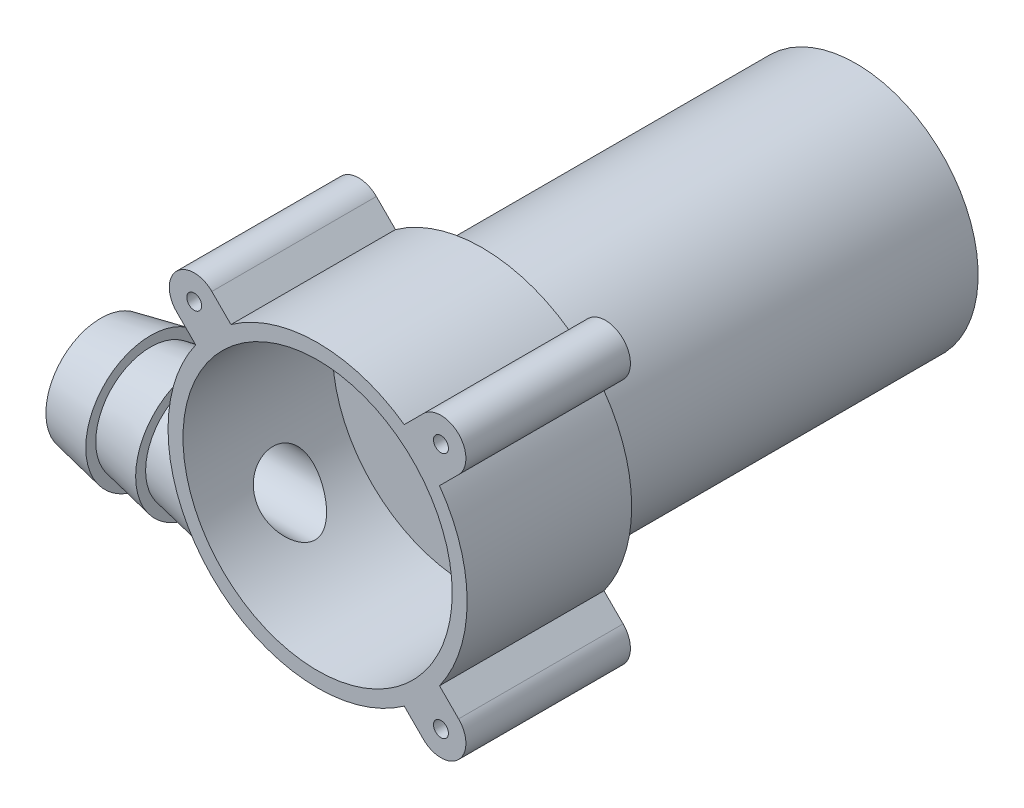
from build123d import *

# Parameters (mm, degrees)
SKETCH1_R                       = 24.5
SKETCH1_R_2                     = 1.5
SKETCH1_R_3                     = 1.75
BOSS_EXTRUDE1_DEPTH             = 3
SKETCH2_R                       = 10
SKETCH2_R_2                     = 8.75
BOSS_EXTRUDE2_DEPTH             = 7
BOSS_EXTRUDE3_START             = 75
SKETCH3_R                       = 24.5
SKETCH3_R_2                     = 23
BOSS_EXTRUDE3_DEPTH             = 75
BOSS_EXTRUDE4_START             = -3
SKETCH4_R                       = 30
SKETCH4_R_2                     = 24.5
BOSS_EXTRUDE4_DEPTH             = 3
SKETCH5_R                       = 30
SKETCH5_R_2                     = 27
BOSS_EXTRUDE5_DEPTH             = 30
BOSS_EXTRUDE6_REACH             = 108.888
BOSS_EXTRUDE6_END_RADIUS        = 30
SKETCH6_R                       = 11
SKETCH6_R_2                     = 6
BOSS_EXTRUDE6_DIRECTION_2_DEPTH = 20
CUT_EXTRUDE1_REACH              = 122.934
SKETCH9_R                       = 6
SKETCH11_R                      = 1.5
BOSS_EXTRUDE7_DEPTH             = 33
CIRPATTERN1_COUNT               = 3
CIRPATTERN1_ANGLE               = 180


with BuildPart() as part:
    # Sketch1 → Boss-Extrude1 (new body)
    with BuildSketch(Plane.XY):
        Circle(SKETCH1_R)
        with Locations((14.5, 0)):
            Circle(SKETCH1_R_2, mode=Mode.SUBTRACT)
        with Locations((0, -14.5)):
            Circle(SKETCH1_R_2, mode=Mode.SUBTRACT)
        with Locations((-14.5, 0)):
            Circle(SKETCH1_R_2, mode=Mode.SUBTRACT)
        with Locations((0, 14.5)):
            Circle(SKETCH1_R_2, mode=Mode.SUBTRACT)
        Circle(SKETCH1_R_3, mode=Mode.SUBTRACT)
    extrude(amount=BOSS_EXTRUDE1_DEPTH)

    # Sketch2 → Boss-Extrude2 (add)
    with BuildSketch(Plane(origin=(0, 0, 0), x_dir=(-1, 0, 0), z_dir=(0, 0, -1))):
        with Locations(Location((0, 0, 0), (0, 0, 180))):
            Circle(SKETCH2_R)
        Circle(SKETCH2_R_2, mode=Mode.SUBTRACT)
    extrude(amount=BOSS_EXTRUDE2_DEPTH)

    # Sketch3 → Boss-Extrude3 (add)
    with BuildSketch(Plane(origin=(0, 0, 0), x_dir=(-1, 0, 0), z_dir=(0, 0, -1)).offset(BOSS_EXTRUDE3_START)):
        Circle(SKETCH3_R)
        Circle(SKETCH3_R_2, mode=Mode.SUBTRACT)
    extrude(amount=-BOSS_EXTRUDE3_DEPTH)

    # Sketch4 → Boss-Extrude4 (add)
    with BuildSketch(Plane.XY.offset(3).offset(BOSS_EXTRUDE4_START)):
        Circle(SKETCH4_R)
        with Locations(Location((0, 0, 0), (0, 0, 180))):
            Circle(SKETCH4_R_2, mode=Mode.SUBTRACT)
    extrude(amount=BOSS_EXTRUDE4_DEPTH)

    # Sketch5 → Boss-Extrude5 (add)
    with BuildSketch(Plane.XY.offset(3)):
        Circle(SKETCH5_R)
        Circle(SKETCH5_R_2, mode=Mode.SUBTRACT)
    extrude(amount=BOSS_EXTRUDE5_DEPTH)

    # Boss-Extrude6: up to this cylinder (the profile starts outside it)
    boss_extrude6_end = Plane(origin=(0, 0, 27.188873), z_dir=(0, 0, 1)) * Cylinder(BOSS_EXTRUDE6_END_RADIUS, 278.776, mode=Mode.PRIVATE)
    # Sketch6 → Boss-Extrude6 (add, up to the surface)
    with BuildSketch(Plane(origin=(-40, 0, 0), x_dir=(0, 0, -1), z_dir=(1, 0, 0)), mode=Mode.PRIVATE) as boss_extrude6_sk1:
        with Locations((-16.5, -15)):
            Circle(SKETCH6_R)
        with Locations((-16.5, -15)):
            Circle(SKETCH6_R_2, mode=Mode.SUBTRACT)
    boss_extrude6_tool1 = extrude(boss_extrude6_sk1.sketch, amount=BOSS_EXTRUDE6_REACH, mode=Mode.PRIVATE) - boss_extrude6_end
    add(boss_extrude6_tool1.solids().sort_by_distance((-40, -15, 27.188873))[0])

    # Sketch6 → Boss-Extrude6 direction 2 (add)
    with BuildSketch(Plane(origin=(-40, 0, 0), x_dir=(0, 0, -1), z_dir=(1, 0, 0))):
        with Locations((-16.5, -15)):
            Circle(SKETCH6_R)
        with Locations((-16.5, -15)):
            Circle(SKETCH6_R_2, mode=Mode.SUBTRACT)
    extrude(amount=-BOSS_EXTRUDE6_DIRECTION_2_DEPTH)

    # Sketch8 → Revolve2 (revolve)
    with BuildSketch(Plane.XY.offset(16.5), mode=Mode.PRIVATE) as revolve2_sk:
        Polygon((-50, -4), (-50, -2), (-60, -4), align=None)
        Polygon((-50, -4), (-40, -4), (-40, -2), align=None)
        Polygon((-40, -4), (-30, -4), (-30, -2), align=None)
    revolve(revolve2_sk.sketch.rotate(Axis((-60, -15, 16.5), (1, 0, 0)), 270), axis=Axis((-60, -15, 16.5), (1, 0, 0)))

    # Sketch9 → Cut-Extrude1 (cut, up to next)
    with BuildSketch(Plane.ZY.offset(60), mode=Mode.PRIVATE) as cut_extrude1_sk1:
        with Locations(Location((16.5, -15, 0), (0, 0, 180))):
            Circle(SKETCH9_R)
    cut_extrude1_tool1 = extrude(cut_extrude1_sk1.sketch, amount=-CUT_EXTRUDE1_REACH, mode=Mode.PRIVATE) & part.part
    add(cut_extrude1_tool1.solids().sort_by_distance((-60, -15, 16.5))[0], mode=Mode.SUBTRACT)

    # Sketch11 → Boss-Extrude7 (add)
    with BuildSketch(Plane.XY):
        with BuildLine():
            Line((-28.284271247, 21.213203436), (-24.452034569, 17.380966757))
            ThreePointArc((-24.452034569, 17.380966757), (-21.213203436, 21.213203436), (-17.380966757, 24.452034569))
            Line((-17.380966757, 24.452034569), (-21.213203436, 28.284271247))
            ThreePointArc((-21.213203436, 28.284271247), (-28.284271247, 28.284271247), (-28.284271247, 21.213203436))
        make_face()
        with Locations((-24.748737342, 24.748737342)):
            Circle(SKETCH11_R, mode=Mode.SUBTRACT)
    boss_extrude7 = extrude(amount=BOSS_EXTRUDE7_DEPTH)

    # CirPattern1: Boss-Extrude7 ×3 about axis
    cirpattern1_axis = Axis((0, 0, 0), (0, 0, -1))
    for i in range(1, CIRPATTERN1_COUNT):
        add(boss_extrude7.rotate(cirpattern1_axis, i * CIRPATTERN1_ANGLE / (CIRPATTERN1_COUNT - 1)))


solid = part.part
